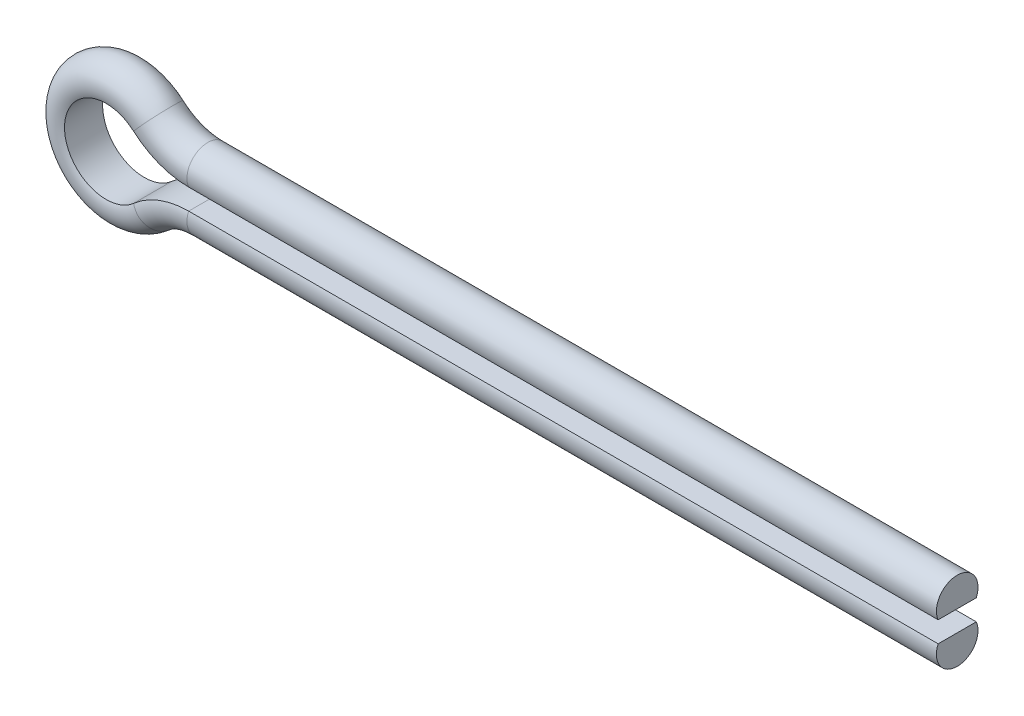
from build123d import *


with BuildPart() as part:
    # Sweep1: sweep along a path in Sketch1
    with BuildLine(Plane.XY) as sweep1_path:
        Line((100, 1.25), (9.921567416, 1.25))
        ThreePointArc((9.921567416, 1.25), (6.386033511, 1.895856533), (3.307189139, 3.75))
        ThreePointArc((3.307189139, 3.75), (-5, 0), (3.307189139, -3.75))
        ThreePointArc((3.307189139, -3.75), (6.386033511, -1.895856533), (9.921567416, -1.25))
        Line((9.921567416, -1.25), (100, -1.25))
    # Sketch2 → Sweep1 (sweep)
    with BuildSketch(Plane(origin=(100, 0, 0), x_dir=(0, 0, -1), z_dir=(1, 0, 0))):
        with BuildLine():
            Line((-2.291287847, -1.25), (2.291287847, -1.25))
            ThreePointArc((2.291287847, -1.25), (0, -4.75), (-2.291287847, -1.25))
        make_face()
    sweep(path=sweep1_path.line)


solid = part.part
